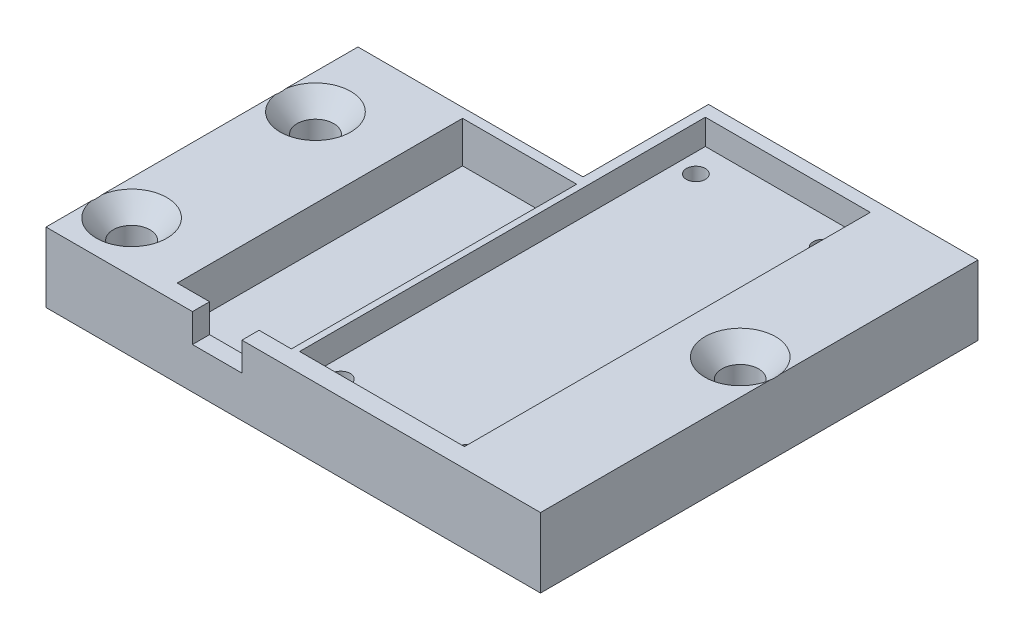
from build123d import *

# Parameters (mm, degrees)
SKETCH1_W                                       = 78
SKETCH1_H                                       = 69
BOSS_EXTRUDE1_DEPTH                             = 11
SKETCH4_W                                       = 18
SKETCH4_H                                       = 45
CUT_EXTRUDE2_DEPTH                              = 6.5
SKETCH5_W                                       = 7.8
SKETCH5_H                                       = 2.7
CUT_EXTRUDE3_DEPTH                              = 4.5
SKETCH6_W                                       = 26
SKETCH6_H                                       = 64
CUT_EXTRUDE4_DEPTH                              = 4
SKETCH8_R                                       = 1.5
CUT_EXTRUDE5_DEPTH                              = 73.645065829
CSK_FOR_12_FLAT_HEAD_MACHINE_SCREW1_D           = 5.7912
CSK_FOR_12_FLAT_HEAD_MACHINE_SCREW1_CSINK_D     = 11.1252
CSK_FOR_12_FLAT_HEAD_MACHINE_SCREW1_CSINK_ANGLE = 82
SKETCH24_W                                      = 35.5
SKETCH24_H                                      = 19.8
CUT_EXTRUDE7_DEPTH                              = 74.138947144


with BuildPart() as part:
    # Sketch1 → Boss-Extrude1 (new body)
    with BuildSketch(Plane(origin=(0, 0, 0), x_dir=(1, 0, 0), z_dir=(0, 1, 0))):
        with Locations((-15.96214511, -12.483701367)):
            Rectangle(SKETCH1_W, SKETCH1_H)
    extrude(amount=BOSS_EXTRUDE1_DEPTH)

    # Sketch4 → Cut-Extrude2 (cut)
    with BuildSketch(Plane(origin=(0, 11, 0), x_dir=(1, 0, 0), z_dir=(0, 1, 0))):
        with Locations((-27.96214511, -21.783701367)):
            Rectangle(SKETCH4_W, SKETCH4_H)
    extrude(amount=-CUT_EXTRUDE2_DEPTH, mode=Mode.SUBTRACT)

    # Sketch5 → Cut-Extrude3 (cut)
    with BuildSketch(Plane(origin=(0, 11, 0), x_dir=(1, 0, 0), z_dir=(0, 1, 0))):
        with Locations((-27.96214511, -45.633701367)):
            Rectangle(SKETCH5_W, SKETCH5_H)
    extrude(amount=-CUT_EXTRUDE3_DEPTH, mode=Mode.SUBTRACT)

    # Sketch6 → Cut-Extrude4 (cut)
    with BuildSketch(Plane(origin=(0, 11, 0), x_dir=(1, 0, 0), z_dir=(0, 1, 0))):
        with Locations((-4.96214511, -11.983701367)):
            Rectangle(SKETCH6_W, SKETCH6_H)
    extrude(amount=-CUT_EXTRUDE4_DEPTH, mode=Mode.SUBTRACT)

    # Sketch8 → Cut-Extrude5 (cut, through all)
    with BuildSketch(Plane(origin=(0, 7, 0), x_dir=(1, 0, 0), z_dir=(0, 1, 0))):
        with Locations(Location((5.03785489, -40.483701367, 0), (0, 0, 270))):
            Circle(SKETCH8_R)
        with Locations(Location((-14.96214511, -40.483701367, 0), (0, 0, 270))):
            Circle(SKETCH8_R)
        with Locations(Location((-14.96214511, 15.516298633, 0), (0, 0, 270))):
            Circle(SKETCH8_R)
        with Locations(Location((5.03785489, 15.516298633, 0), (0, 0, 270))):
            Circle(SKETCH8_R)
    extrude(amount=-CUT_EXTRUDE5_DEPTH, mode=Mode.SUBTRACT)

    # CSK for #12 Flat Head Machine Screw1 (through all)
    with Locations(Plane(origin=(0, 11, 0), x_dir=(1, 0, 0), z_dir=(0, 1, 0))):
        with Locations((-49.46214511, -38.983701367), (-49.46214511, -9.983701367), (17.53785489, -9.983701367)):
            CounterSinkHole(CSK_FOR_12_FLAT_HEAD_MACHINE_SCREW1_D / 2, CSK_FOR_12_FLAT_HEAD_MACHINE_SCREW1_CSINK_D / 2, counter_sink_angle=CSK_FOR_12_FLAT_HEAD_MACHINE_SCREW1_CSINK_ANGLE)

    # Sketch24 → Cut-Extrude7 (cut, through all)
    with BuildSketch(Plane(origin=(0, 11, 0), x_dir=(1, 0, 0), z_dir=(0, 1, 0))):
        with Locations((-37.21214511, 12.116298633)):
            Rectangle(SKETCH24_W, SKETCH24_H)
    extrude(amount=-CUT_EXTRUDE7_DEPTH, mode=Mode.SUBTRACT)


solid = part.part
